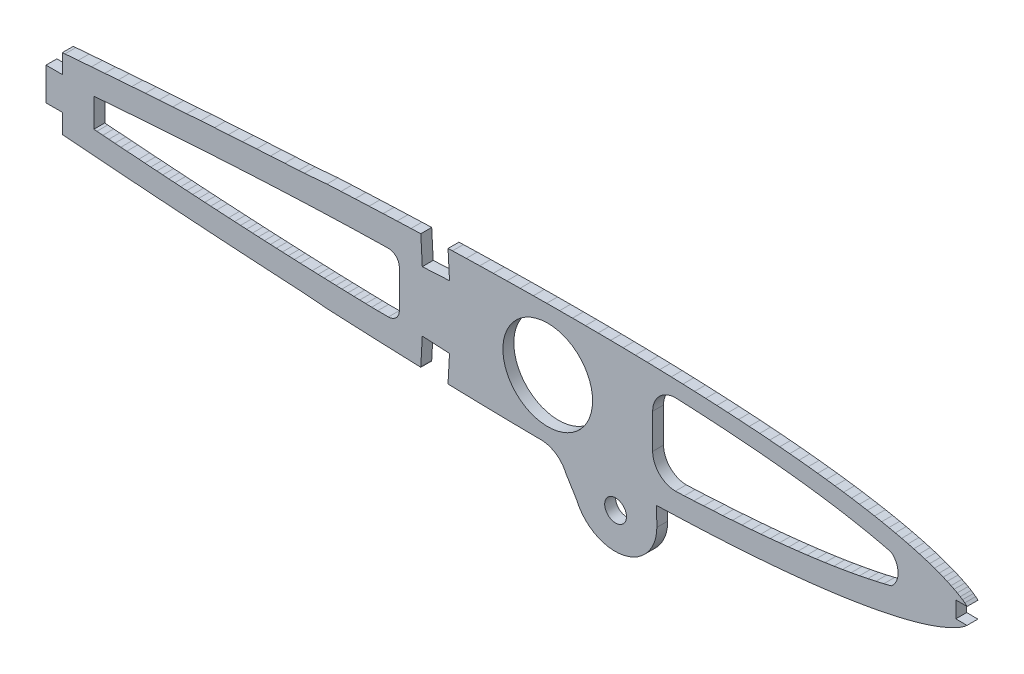
from build123d import *

# Parameters (mm, degrees)
MODEL_R         = 8.224745022
MODEL_R_2       = 2
EXTRUDE_1_DEPTH = 2


with BuildPart() as part:
    # Model → 凸台-拉伸1 (new body)
    with BuildSketch(Plane.XY):
        with BuildLine():
            Line((172.830320338, 26.428132287), (170.782965757, 26.448132287))
            Line((170.782965757, 26.448132287), (170.782965757, 29.448132287))
            Line((170.782965757, 29.448132287), (172.85167492, 29.448132287))
            Line((172.85167492, 29.448132287), (172.421965757, 29.808132287))
            Line((172.421965757, 29.808132287), (172.014965757, 30.104132287))
            Line((172.014965757, 30.104132287), (171.593965757, 30.380132287))
            Line((171.593965757, 30.380132287), (171.040965757, 30.704132287))
            Line((171.040965757, 30.704132287), (170.475965757, 31.003132287))
            Line((170.475965757, 31.003132287), (169.900965757, 31.284132287))
            Line((169.900965757, 31.284132287), (169.186965757, 31.612132287))
            Line((169.186965757, 31.612132287), (168.464965757, 31.921132287))
            Line((168.464965757, 31.921132287), (167.735965757, 32.213132287))
            Line((167.735965757, 32.213132287), (166.866965757, 32.537132287))
            Line((166.866965757, 32.537132287), (165.990965757, 32.839132287))
            Line((165.990965757, 32.839132287), (165.106965757, 33.123132287))
            Line((165.106965757, 33.123132287), (164.083965757, 33.430132287))
            Line((164.083965757, 33.430132287), (163.055965757, 33.718132287))
            Line((163.055965757, 33.718132287), (162.023965757, 33.990132287))
            Line((162.023965757, 33.990132287), (160.852965757, 34.281132287))
            Line((160.852965757, 34.281132287), (159.677965757, 34.555132287))
            Line((159.677965757, 34.555132287), (158.499965757, 34.813132287))
            Line((158.499965757, 34.813132287), (157.185965757, 35.083132287))
            Line((157.185965757, 35.083132287), (155.868965757, 35.337132287))
            Line((155.868965757, 35.337132287), (154.548965757, 35.576132287))
            Line((154.548965757, 35.576132287), (153.096965757, 35.824132287))
            Line((153.096965757, 35.824132287), (151.643965757, 36.057132287))
            Line((151.643965757, 36.057132287), (150.186965757, 36.276132287))
            Line((150.186965757, 36.276132287), (148.603965757, 36.499132287))
            Line((148.603965757, 36.499132287), (147.017965757, 36.708132287))
            Line((147.017965757, 36.708132287), (145.430965757, 36.903132287))
            Line((145.430965757, 36.903132287), (143.719965757, 37.100132287))
            Line((143.719965757, 37.100132287), (142.008965757, 37.283132287))
            Line((142.008965757, 37.283132287), (140.295965757, 37.454132287))
            Line((140.295965757, 37.454132287), (138.466965757, 37.625132287))
            Line((138.466965757, 37.625132287), (136.637965757, 37.783132287))
            Line((136.637965757, 37.783132287), (134.807965757, 37.929132287))
            Line((134.807965757, 37.929132287), (132.867965757, 38.072132287))
            Line((132.867965757, 38.072132287), (130.927965757, 38.202132287))
            Line((130.927965757, 38.202132287), (128.985965757, 38.322132287))
            Line((128.985965757, 38.322132287), (126.941965757, 38.436132287))
            Line((126.941965757, 38.436132287), (124.897965757, 38.538132287))
            Line((124.897965757, 38.538132287), (122.852965757, 38.631132287))
            Line((122.852965757, 38.631132287), (120.712965757, 38.717132287))
            Line((120.712965757, 38.717132287), (118.573965757, 38.792132287))
            Line((118.573965757, 38.792132287), (116.433965757, 38.858132287))
            Line((116.433965757, 38.858132287), (114.206965757, 38.916132287))
            Line((114.206965757, 38.916132287), (111.980965757, 38.965132287))
            Line((111.980965757, 38.965132287), (109.753965757, 39.004132287))
            Line((109.753965757, 39.004132287), (107.448965757, 39.034132287))
            Line((107.448965757, 39.034132287), (105.143965757, 39.056132287))
            Line((105.143965757, 39.056132287), (102.837965757, 39.068132287))
            Line((102.837965757, 39.068132287), (100.462965757, 39.072132287))
            Line((100.462965757, 39.072132287), (98.088965757, 39.068132287))
            Line((98.088965757, 39.068132287), (95.713965757, 39.056132287))
            Line((95.713965757, 39.056132287), (93.279965757, 39.035132287))
            Line((93.279965757, 39.035132287), (90.846965757, 39.006132287))
            Line((90.846965757, 39.006132287), (88.411965757, 38.969132287))
            Line((88.411965757, 38.969132287), (85.927965757, 38.924132287))
            Line((85.927965757, 38.924132287), (83.443965757, 38.871132287))
            Line((83.443965757, 38.871132287), (80.959965757, 38.811132287))
            Line((80.959965757, 38.811132287), (78.433965757, 38.744132287))
            Line((78.433965757, 38.744132287), (77.621480684, 38.718999067))
            Line((77.621480684, 38.718999067), (77.892340677, 33.729578099))
            Line((77.892340677, 33.729578099), (72.899340677, 33.458578099))
            Line((72.899340677, 33.458578099), (72.62618591, 38.563051071))
            Line((72.62618591, 38.563051071), (70.827965757, 38.500132287))
            Line((70.827965757, 38.500132287), (68.273965757, 38.405132287))
            Line((68.273965757, 38.405132287), (65.718965757, 38.304132287))
            Line((65.718965757, 38.304132287), (63.141965757, 38.197132287))
            Line((63.141965757, 38.197132287), (60.565965757, 38.084132287))
            Line((60.565965757, 38.084132287), (57.988965757, 37.966132287))
            Line((57.988965757, 37.966132287), (55.402965757, 37.841132287))
            Line((55.402965757, 37.841132287), (51.241567883, 37.482541654))
            Line((51.241567883, 37.482541654), (50.235007426, 37.426881118))
            Line((50.235007426, 37.426881118), (47.650007426, 37.278881118))
            Line((47.650007426, 37.278881118), (45.065007426, 37.127881118))
            Line((45.065007426, 37.127881118), (42.488007426, 36.974881118))
            Line((42.488007426, 36.974881118), (39.912007426, 36.818881118))
            Line((39.912007426, 36.818881118), (37.335007426, 36.657881118))
            Line((37.335007426, 36.657881118), (34.780007426, 36.492881118))
            Line((34.780007426, 36.492881118), (32.225007426, 36.322881118))
            Line((32.225007426, 36.322881118), (29.670007426, 36.148881118))
            Line((29.670007426, 36.148881118), (27.144007426, 35.973881118))
            Line((27.144007426, 35.973881118), (24.620007426, 35.796881118))
            Line((24.620007426, 35.796881118), (22.094007426, 35.614881118))
            Line((22.094007426, 35.614881118), (19.609007426, 35.433881118))
            Line((19.609007426, 35.433881118), (17.126007426, 35.247881118))
            Line((17.126007426, 35.247881118), (14.642007426, 35.059881118))
            Line((14.642007426, 35.059881118), (12.207007426, 34.871881118))
            Line((12.207007426, 34.871881118), (9.774007426, 34.680881118))
            Line((9.774007426, 34.680881118), (7.340007426, 34.488881118))
            Line((7.340007426, 34.488881118), (6.86331368, 34.450745618))
            Line((6.86331368, 34.450745618), (6.86331368, 30.967216618))
            Line((6.86331368, 30.967216618), (3.86331368, 30.967216618))
            Line((3.86331368, 30.967216618), (3.86331368, 24.967216618))
            Line((3.86331368, 24.967216618), (6.86331368, 24.967216618))
            Line((6.86331368, 24.967216618), (6.86331368, 21.440016618))
            Line((6.86331368, 21.440016618), (7.340007426, 21.401881118))
            Line((7.340007426, 21.401881118), (9.774007426, 21.209881118))
            Line((9.774007426, 21.209881118), (12.207007426, 21.018881118))
            Line((12.207007426, 21.018881118), (14.642007426, 20.830881118))
            Line((14.642007426, 20.830881118), (17.126007426, 20.642881118))
            Line((17.126007426, 20.642881118), (19.609007426, 20.456881118))
            Line((19.609007426, 20.456881118), (22.094007426, 20.275881118))
            Line((22.094007426, 20.275881118), (24.620007426, 20.093881118))
            Line((24.620007426, 20.093881118), (27.144007426, 19.916881118))
            Line((27.144007426, 19.916881118), (29.670007426, 19.741881118))
            Line((29.670007426, 19.741881118), (32.225007426, 19.567881118))
            Line((32.225007426, 19.567881118), (34.780007426, 19.397881118))
            Line((34.780007426, 19.397881118), (37.335007426, 19.232881118))
            Line((37.335007426, 19.232881118), (39.912007426, 19.071881118))
            Line((39.912007426, 19.071881118), (42.488007426, 18.915881118))
            Line((42.488007426, 18.915881118), (45.065007426, 18.762881118))
            Line((45.065007426, 18.762881118), (47.650007426, 18.611881118))
            Line((47.650007426, 18.611881118), (50.235007426, 18.463881118))
            Line((50.235007426, 18.463881118), (51.241567817, 18.408220586))
            Line((51.241567817, 18.408220586), (55.402965757, 18.055132287))
            Line((55.402965757, 18.055132287), (57.988965757, 17.930132287))
            Line((57.988965757, 17.930132287), (60.565965757, 17.812132287))
            Line((60.565965757, 17.812132287), (63.141965757, 17.699132287))
            Line((63.141965757, 17.699132287), (65.718965757, 17.592132287))
            Line((65.718965757, 17.592132287), (68.273965757, 17.491132287))
            Line((68.273965757, 17.491132287), (70.827965757, 17.396132287))
            Line((70.827965757, 17.396132287), (72.622384686, 17.333650564))
            Line((72.622384686, 17.333650564), (72.62618591, 17.446363372))
            Line((72.62618591, 17.446363372), (72.89618591, 22.439363372))
            Line((72.89618591, 22.439363372), (77.88918591, 22.168363372))
            Line((77.88918591, 22.168363372), (77.61818591, 17.176363372))
            Line((77.61818591, 17.176363372), (78.433965757, 17.152132287))
            Line((78.433965757, 17.152132287), (80.959965757, 17.085132287))
            Line((80.959965757, 17.085132287), (83.443965757, 17.025132287))
            Line((83.443965757, 17.025132287), (85.927965757, 16.972132287))
            Line((85.927965757, 16.972132287), (88.411965757, 16.927132287))
            Line((88.411965757, 16.927132287), (90.846965757, 16.890132287))
            Line((90.846965757, 16.890132287), (93.279965757, 16.861132287))
            Line((93.279965757, 16.861132287), (94.711178014, 16.848846558))
            ThreePointArc((94.711178014, 16.848846558), (97.426725757, 15.993489849), (99.235141937, 13.794520645))
            Line((99.235141937, 13.794520645), (101.2257433, 10.569320701))
            ThreePointArc((101.2257433, 10.569320701), (109.795657459, 6.063588306), (115.932037196, 13.552907156))
            Line((115.932037196, 13.552907156), (115.877215757, 17.023632287))
            Line((115.877215757, 17.023632287), (116.433965757, 17.038132287))
            Line((116.433965757, 17.038132287), (118.573965757, 17.104132287))
            Line((118.573965757, 17.104132287), (120.712965757, 17.179132287))
            Line((120.712965757, 17.179132287), (122.852965757, 17.265132287))
            Line((122.852965757, 17.265132287), (124.897965757, 17.358132287))
            Line((124.897965757, 17.358132287), (126.941965757, 17.460132287))
            Line((126.941965757, 17.460132287), (128.985965757, 17.574132287))
            Line((128.985965757, 17.574132287), (130.927965757, 17.694132287))
            Line((130.927965757, 17.694132287), (132.867965757, 17.824132287))
            Line((132.867965757, 17.824132287), (134.807965757, 17.967132287))
            Line((134.807965757, 17.967132287), (136.637965757, 18.113132287))
            Line((136.637965757, 18.113132287), (138.466965757, 18.271132287))
            Line((138.466965757, 18.271132287), (140.295965757, 18.442132287))
            Line((140.295965757, 18.442132287), (142.008965757, 18.613132287))
            Line((142.008965757, 18.613132287), (143.719965757, 18.796132287))
            Line((143.719965757, 18.796132287), (145.430965757, 18.993132287))
            Line((145.430965757, 18.993132287), (147.017965757, 19.188132287))
            Line((147.017965757, 19.188132287), (148.603965757, 19.397132287))
            Line((148.603965757, 19.397132287), (150.186965757, 19.620132287))
            Line((150.186965757, 19.620132287), (151.643965757, 19.839132287))
            Line((151.643965757, 19.839132287), (153.096965757, 20.072132287))
            Line((153.096965757, 20.072132287), (154.548965757, 20.320132287))
            Line((154.548965757, 20.320132287), (155.868965757, 20.559132287))
            Line((155.868965757, 20.559132287), (157.185965757, 20.813132287))
            Line((157.185965757, 20.813132287), (158.499965757, 21.083132287))
            Line((158.499965757, 21.083132287), (159.677965757, 21.341132287))
            Line((159.677965757, 21.341132287), (160.852965757, 21.615132287))
            Line((160.852965757, 21.615132287), (162.023965757, 21.906132287))
            Line((162.023965757, 21.906132287), (163.055965757, 22.178132287))
            Line((163.055965757, 22.178132287), (164.083965757, 22.466132287))
            Line((164.083965757, 22.466132287), (165.106965757, 22.773132287))
            Line((165.106965757, 22.773132287), (165.990965757, 23.057132287))
            Line((165.990965757, 23.057132287), (166.866965757, 23.359132287))
            Line((166.866965757, 23.359132287), (167.735965757, 23.683132287))
            Line((167.735965757, 23.683132287), (168.464965757, 23.975132287))
            Line((168.464965757, 23.975132287), (169.186965757, 24.284132287))
            Line((169.186965757, 24.284132287), (169.900965757, 24.612132287))
            Line((169.900965757, 24.612132287), (170.475965757, 24.893132287))
            Line((170.475965757, 24.893132287), (171.040965757, 25.192132287))
            Line((171.040965757, 25.192132287), (171.593965757, 25.516132287))
            Line((171.593965757, 25.516132287), (172.014965757, 25.792132287))
            Line((172.014965757, 25.792132287), (172.421965757, 26.088132287))
            Line((172.421965757, 26.088132287), (172.808965757, 26.408132287))
            Line((172.808965757, 26.408132287), (172.830320338, 26.428132287))
        make_face()
        with Locations((95.915365058, 27.769901212)):
            Circle(MODEL_R, mode=Mode.SUBTRACT)
        with Locations((108.36168443, 12.461434957)):
            Circle(MODEL_R_2, mode=Mode.SUBTRACT)
        with BuildLine():
            Line((158.950343283, 31.098631312), (157.570856099, 31.443503108))
            Line((157.570856099, 31.443503108), (156.115496376, 31.779717066))
            Line((156.115496376, 31.779717066), (154.645234417, 32.09697166))
            Line((154.645234417, 32.09697166), (153.120138653, 32.401990812))
            Line((153.120138653, 32.401990812), (151.576060197, 32.690603608))
            Line((151.576060197, 32.690603608), (149.995595117, 32.967666846))
            Line((149.995595117, 32.967666846), (148.410670425, 33.225397761))
            Line((148.410670425, 33.225397761), (146.785681146, 33.470724991))
            Line((146.785681146, 33.470724991), (145.149847612, 33.702671537))
            Line((145.149847612, 33.702671537), (143.49081053, 33.92257336))
            Line((143.49081053, 33.92257336), (141.827504313, 34.128040598))
            Line((141.827504313, 34.128040598), (140.13770437, 34.322072859))
            Line((140.13770437, 34.322072859), (138.441259264, 34.504539339))
            Line((138.441259264, 34.504539339), (136.72687696, 34.677210938))
            Line((136.72687696, 34.677210938), (135.010926707, 34.837695494))
            Line((135.010926707, 34.837695494), (133.282596904, 34.988307091))
            Line((133.282596904, 34.988307091), (131.545662456, 35.127063623))
            Line((131.545662456, 35.127063623), (129.792809859, 35.258838357))
            Line((129.792809859, 35.258838357), (128.044876797, 35.380325903))
            Line((128.044876797, 35.380325903), (126.281823992, 35.492226293))
            Line((126.281823992, 35.492226293), (124.5101688, 35.597028431))
            Line((124.5101688, 35.597028431), (122.738519931, 35.694070996))
            Line((122.738519931, 35.694070996), (120.959021961, 35.781423631))
            Line((120.959021961, 35.781423631), (119.321924226, 35.856981988))
            ThreePointArc((119.321924226, 35.856981988), (116.376198778, 34.591107449), (115.162256989, 31.623603094))
            Line((115.162256989, 31.623603094), (115.162256989, 25.242249712))
            ThreePointArc((115.162256989, 25.242249712), (116.376198778, 22.274745357), (119.321924226, 21.008870818))
            Line((119.321924226, 21.008870818), (120.959021961, 21.084429175))
            Line((120.959021961, 21.084429175), (122.738519931, 21.17178181))
            Line((122.738519931, 21.17178181), (124.5101688, 21.268824375))
            Line((124.5101688, 21.268824375), (126.281823992, 21.373626513))
            Line((126.281823992, 21.373626513), (128.044876797, 21.485526902))
            Line((128.044876797, 21.485526902), (129.792809859, 21.607014448))
            Line((129.792809859, 21.607014448), (131.545662456, 21.738789183))
            Line((131.545662456, 21.738789183), (133.282596904, 21.877545715))
            Line((133.282596904, 21.877545715), (135.010926707, 22.028157312))
            Line((135.010926707, 22.028157312), (136.72687696, 22.188641868))
            Line((136.72687696, 22.188641868), (138.441259264, 22.361313467))
            Line((138.441259264, 22.361313467), (140.13770437, 22.543779946))
            Line((140.13770437, 22.543779946), (141.827504313, 22.737812207))
            Line((141.827504313, 22.737812207), (143.49081053, 22.943279446))
            Line((143.49081053, 22.943279446), (145.149847612, 23.163181268))
            Line((145.149847612, 23.163181268), (146.785681146, 23.395127814))
            Line((146.785681146, 23.395127814), (148.410670425, 23.640455044))
            Line((148.410670425, 23.640455044), (149.995595117, 23.898185959))
            Line((149.995595117, 23.898185959), (151.576060197, 24.175249198))
            Line((151.576060197, 24.175249198), (153.120138653, 24.463861993))
            Line((153.120138653, 24.463861993), (154.645234417, 24.768881146))
            Line((154.645234417, 24.768881146), (156.115496376, 25.086135739))
            Line((156.115496376, 25.086135739), (157.570856099, 25.422349698))
            Line((157.570856099, 25.422349698), (158.950343283, 25.767221494))
            ThreePointArc((158.950343283, 25.767221494), (160.194728583, 28.432926403), (158.950343283, 31.098631312))
        make_face(mode=Mode.SUBTRACT)
        with BuildLine():
            Line((12.645011616, 30.422954718), (13.196863949, 30.466143155))
            Line((13.196863949, 30.466143155), (14.294297639, 30.550926821))
            Line((14.294297639, 30.550926821), (15.393322058, 30.634639236))
            Line((15.393322058, 30.634639236), (16.496122058, 30.717439236))
            Line((16.496122058, 30.717439236), (17.597033804, 30.801295408))
            Line((17.597033804, 30.801295408), (18.694168129, 30.882476185))
            Line((18.694168129, 30.882476185), (19.795079116, 30.962738466))
            Line((19.795079116, 30.962738466), (20.896125649, 31.043010629))
            Line((20.896125649, 31.043010629), (21.993946459, 31.121938923))
            Line((21.993946459, 31.121938923), (23.094720697, 31.199795642))
            Line((23.094720697, 31.199795642), (24.192803629, 31.277546602))
            Line((24.192803629, 31.277546602), (25.290618338, 31.352886827))
            Line((25.290618338, 31.352886827), (26.391395492, 31.428348146))
            Line((26.391395492, 31.428348146), (27.489338571, 31.502501164))
            Line((27.489338571, 31.502501164), (28.587151049, 31.575449488))
            Line((28.587151049, 31.575449488), (29.685084603, 31.647209851))
            Line((29.685084603, 31.647209851), (30.781695486, 31.717766058))
            Line((30.781695486, 31.717766058), (31.879383662, 31.787118906))
            Line((31.879383662, 31.787118906), (32.979088444, 31.855401229))
            Line((32.979088444, 31.855401229), (34.075815072, 31.923572887))
            Line((34.075815072, 31.923572887), (35.171720991, 31.989231739))
            Line((35.171720991, 31.989231739), (36.270336331, 32.053926644))
            Line((36.270336331, 32.053926644), (37.366938823, 32.118503018))
            Line((37.366938823, 32.118503018), (38.461641493, 32.180579941))
            Line((38.461641493, 32.180579941), (39.558242341, 32.241568647))
            Line((39.558242341, 32.241568647), (40.654842506, 32.301361459))
            Line((40.654842506, 32.301361459), (41.749541423, 32.359856821))
            Line((41.749541423, 32.359856821), (42.846140048, 32.416061985))
            Line((42.846140048, 32.416061985), (43.941635371, 32.472271892))
            Line((43.941635371, 32.472271892), (45.036233563, 32.525987179))
            Line((45.036233563, 32.525987179), (46.1329192, 32.578608955))
            Line((46.1329192, 32.578608955), (47.228402195, 32.630034467))
            Line((47.228402195, 32.630034467), (48.32180541, 32.680168675))
            Line((48.32180541, 32.680168675), (49.418312613, 32.727998869))
            Line((49.418312613, 32.727998869), (50.511962923, 32.775756521))
            Line((50.511962923, 32.775756521), (51.605446251, 32.819925607))
            Line((51.605446251, 32.819925607), (52.700907204, 32.864174576))
            Line((52.700907204, 32.864174576), (53.793188544, 32.905955829))
            Line((53.793188544, 32.905955829), (54.886662467, 32.946543289))
            Line((54.886662467, 32.946543289), (55.979006346, 32.98474548))
            Line((55.979006346, 32.98474548), (57.071278299, 33.021751415))
            Line((57.071278299, 33.021751415), (58.163549432, 33.056369844))
            Line((58.163549432, 33.056369844), (59.257729663, 33.089852955))
            Line((59.257729663, 33.089852955), (60.348139059, 33.12202897))
            Line((60.348139059, 33.12202897), (61.437345214, 33.150629569))
            Line((61.437345214, 33.150629569), (62.530365623, 33.178134459))
            Line((62.530365623, 33.178134459), (63.620226487, 33.204396167))
            Line((63.620226487, 33.204396167), (64.709364975, 33.228228519))
            Line((64.709364975, 33.228228519), (65.797344335, 33.249678276))
            Line((65.797344335, 33.249678276), (66.648646132, 33.264597037))
            ThreePointArc((66.648646132, 33.264597037), (68.085458955, 32.691453731), (68.683690039, 31.26490408))
            Line((68.683690039, 31.26490408), (68.683690039, 24.36593305))
            ThreePointArc((68.683690039, 24.36593305), (68.097903601, 22.951719487), (66.683690039, 22.36593305))
            Line((66.683690039, 22.36593305), (64.708727029, 22.36593305))
            Line((64.708727029, 22.36593305), (63.620226487, 22.389751442))
            Line((63.620226487, 22.389751442), (62.530365623, 22.41601315))
            Line((62.530365623, 22.41601315), (61.437345214, 22.44351804))
            Line((61.437345214, 22.44351804), (60.348139059, 22.472118639))
            Line((60.348139059, 22.472118639), (59.257729663, 22.504294654))
            Line((59.257729663, 22.504294654), (58.163549432, 22.537777765))
            Line((58.163549432, 22.537777765), (57.071278299, 22.572396194))
            Line((57.071278299, 22.572396194), (55.979006346, 22.609402129))
            Line((55.979006346, 22.609402129), (54.886662467, 22.64760432))
            Line((54.886662467, 22.64760432), (53.793188544, 22.68819178))
            Line((53.793188544, 22.68819178), (52.700907204, 22.729973033))
            Line((52.700907204, 22.729973033), (51.605446251, 22.774222002))
            Line((51.605446251, 22.774222002), (50.511962923, 22.818391088))
            Line((50.511962923, 22.818391088), (49.418312613, 22.86614874))
            Line((49.418312613, 22.86614874), (48.32180541, 22.913978934))
            Line((48.32180541, 22.913978934), (47.228402195, 22.964113142))
            Line((47.228402195, 22.964113142), (46.1329192, 23.015538654))
            Line((46.1329192, 23.015538654), (45.036233563, 23.068160429))
            Line((45.036233563, 23.068160429), (43.941635371, 23.121875717))
            Line((43.941635371, 23.121875717), (42.846140048, 23.178085624))
            Line((42.846140048, 23.178085624), (41.749541423, 23.234290788))
            Line((41.749541423, 23.234290788), (40.654842506, 23.29278615))
            Line((40.654842506, 23.29278615), (39.558242341, 23.352578962))
            Line((39.558242341, 23.352578962), (38.461641493, 23.413567668))
            Line((38.461641493, 23.413567668), (37.366938823, 23.475644591))
            Line((37.366938823, 23.475644591), (36.270336331, 23.540220965))
            Line((36.270336331, 23.540220965), (35.171720991, 23.60491587))
            Line((35.171720991, 23.60491587), (34.075815072, 23.670574722))
            Line((34.075815072, 23.670574722), (32.979088444, 23.73874638))
            Line((32.979088444, 23.73874638), (31.879383662, 23.807028703))
            Line((31.879383662, 23.807028703), (30.781695486, 23.876381551))
            Line((30.781695486, 23.876381551), (29.685084603, 23.946937758))
            Line((29.685084603, 23.946937758), (28.587151049, 24.018698121))
            Line((28.587151049, 24.018698121), (27.489338571, 24.091646445))
            Line((27.489338571, 24.091646445), (26.391395492, 24.165799463))
            Line((26.391395492, 24.165799463), (25.290618338, 24.241260782))
            Line((25.290618338, 24.241260782), (24.192803629, 24.316601007))
            Line((24.192803629, 24.316601007), (23.094720697, 24.394351967))
            Line((23.094720697, 24.394351967), (21.993946459, 24.472208686))
            Line((21.993946459, 24.472208686), (20.896125649, 24.55113698))
            Line((20.896125649, 24.55113698), (19.795079116, 24.631409143))
            Line((19.795079116, 24.631409143), (18.694168129, 24.711671424))
            Line((18.694168129, 24.711671424), (17.597033804, 24.792852201))
            Line((17.597033804, 24.792852201), (16.496122058, 24.876708373))
            Line((16.496122058, 24.876708373), (15.393322058, 24.959508373))
            Line((15.393322058, 24.959508373), (14.294297639, 25.043220788))
            Line((14.294297639, 25.043220788), (13.196863949, 25.128004453))
            Line((13.196863949, 25.128004453), (12.645351046, 25.171166327))
            Line((12.645351046, 25.171166327), (12.645011616, 30.422954718))
        make_face(mode=Mode.SUBTRACT)
    extrude(amount=EXTRUDE_1_DEPTH)


solid = part.part
